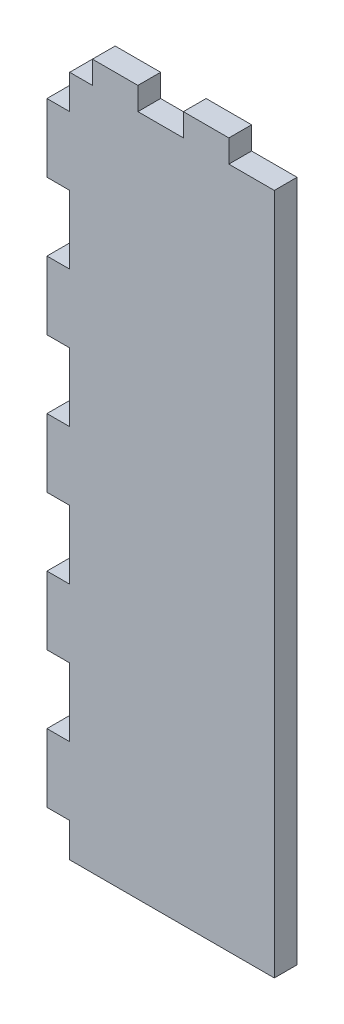
from build123d import *

# Parameters (mm, degrees)
ESQUISSE1_W             = 50
ESQUISSE1_H             = 155
BOSS_EXTRU_1_DEPTH      = 5
ESQUISSE4_W             = 5
ESQUISSE4_H             = 15
ESQUISSE4_H_2           = 7.5
ESQUISSE4_W_2           = 10
ESQUISSE4_H_3           = 5
ENL_V_MAT_EXTRU_4_DEPTH = 5
ESQUISSE7_W             = 10
ESQUISSE7_H             = 5
ENL_V_MAT_EXTRU_5_DEPTH = 5
ESQUISSE8_W             = 5
ESQUISSE8_H             = 7.5
ENL_V_MAT_EXTRU_6_DEPTH = 5


with BuildPart() as part:
    # Esquisse1 → Boss.-Extru.1 (new body)
    with BuildSketch(Plane.XY):
        with Locations((-32.839977645, -27.727272727)):
            Rectangle(ESQUISSE1_W, ESQUISSE1_H)
    extrude(amount=BOSS_EXTRU_1_DEPTH)

    # Esquisse4 → Enlèv. mat.-Extru.4 (cut)
    with BuildSketch(Plane.XY.offset(5)):
        with Locations((-55.339977645, 14.772727273)):
            Rectangle(ESQUISSE4_W, ESQUISSE4_H)
        with Locations((-55.339977645, -15.227272727)):
            Rectangle(ESQUISSE4_W, ESQUISSE4_H)
        with Locations((-55.339977645, -45.227272727)):
            Rectangle(ESQUISSE4_W, ESQUISSE4_H)
        with Locations((-55.339977645, -75.227272727)):
            Rectangle(ESQUISSE4_W, ESQUISSE4_H)
        with Locations((-55.339977645, -101.477272727)):
            Rectangle(ESQUISSE4_W, ESQUISSE4_H_2)
        with Locations((-32.839977645, 47.272727273)):
            Rectangle(ESQUISSE4_W_2, ESQUISSE4_H_3)
        with Locations((-12.839977645, 47.272727273)):
            Rectangle(ESQUISSE4_W_2, ESQUISSE4_H_3)
    extrude(amount=-ENL_V_MAT_EXTRU_4_DEPTH, mode=Mode.SUBTRACT)

    # Esquisse7 → Enlèv. mat.-Extru.5 (cut)
    with BuildSketch(Plane.XY.offset(5)):
        with Locations((-52.839977645, 47.272727273)):
            Rectangle(ESQUISSE7_W, ESQUISSE7_H)
    extrude(amount=-ENL_V_MAT_EXTRU_5_DEPTH, mode=Mode.SUBTRACT)

    # Esquisse8 → Enlèv. mat.-Extru.6 (cut)
    with BuildSketch(Plane.XY.offset(5)):
        with Locations((-55.339977645, 41.022727273)):
            Rectangle(ESQUISSE8_W, ESQUISSE8_H)
    extrude(amount=-ENL_V_MAT_EXTRU_6_DEPTH, mode=Mode.SUBTRACT)


solid = part.part
